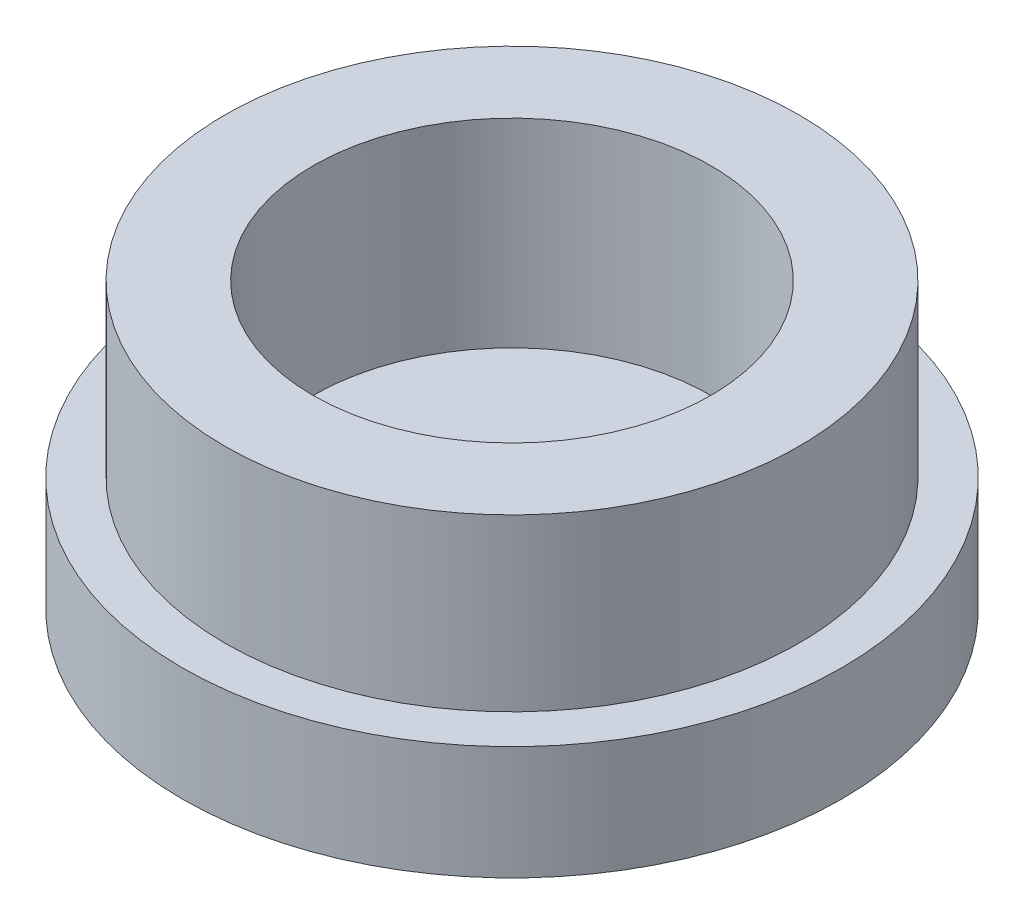
from build123d import *

# Parameters (mm, degrees)
SKETCH1_R           = 5.8
BOSS_EXTRUDE1_DEPTH = 5
SKETCH2_R           = 3.5
CUT_EXTRUDE1_DEPTH  = 3.5
SKETCH3_R           = 8.275638688
SKETCH3_R_2         = 5.05
CUT_EXTRUDE2_DEPTH  = 3


with BuildPart() as part:
    # Sketch1 → Boss-Extrude1 (new body)
    with BuildSketch(Plane(origin=(0, 0, 0), x_dir=(1, 0, 0), z_dir=(0, 1, 0))):
        with Locations(Location((0, 0, 0), (0, 0, 270))):
            Circle(SKETCH1_R)
    extrude(amount=BOSS_EXTRUDE1_DEPTH)

    # Sketch2 → Cut-Extrude1 (cut)
    with BuildSketch(Plane(origin=(0, 5, 0), x_dir=(1, 0, 0), z_dir=(0, 1, 0))):
        with Locations(Location((0, 0, 0), (0, 0, 270))):
            Circle(SKETCH2_R)
    extrude(amount=-CUT_EXTRUDE1_DEPTH, mode=Mode.SUBTRACT)

    # Sketch3 → Cut-Extrude2 (cut)
    with BuildSketch(Plane(origin=(0, 5, 0), x_dir=(1, 0, 0), z_dir=(0, 1, 0))):
        Circle(SKETCH3_R)
        with Locations(Location((0, 0, 0), (0, 0, 270))):
            Circle(SKETCH3_R_2, mode=Mode.SUBTRACT)
    extrude(amount=-CUT_EXTRUDE2_DEPTH, mode=Mode.SUBTRACT)


solid = part.part
